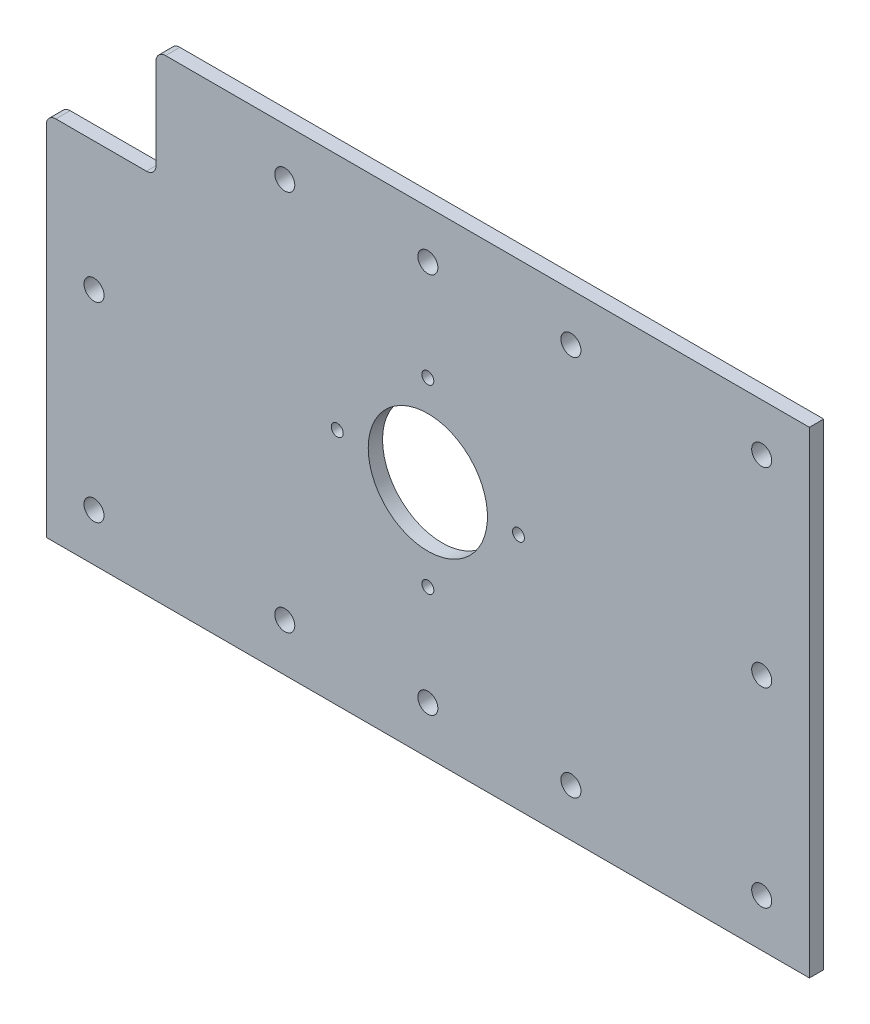
from build123d import *

# Parameters (mm, degrees)
SKETCH_1_W               = 160
SKETCH_1_H               = 100
EXTRUDE_1_DEPTH          = 3
SKETCH_2_R               = 2.1
CUT_EXTRUDE_1_DEPTH      = 95.387499172
CUT_EXTRUDE_2_DEPTH      = 95.387499172
CUT_EXTRUDE_2_DEPTH_BACK = 95.387499172
SKETCH_3_R               = 1.25
CUT_EXTRUDE_3_DEPTH      = 95.387499172
CUT_EXTRUDE_3_DEPTH_BACK = 95.387499172
SKETCH_4_R               = 12.5
CUT_EXTRUDE_4_DEPTH      = 95.387499172
CUT_EXTRUDE_4_DEPTH_BACK = 95.387499172
SKETCH_5_W               = 23
SKETCH_5_H               = 23
FILLET_1_R               = 2


with BuildPart() as part:
    # 草图1 → 凸台-拉伸1 (new body)
    with BuildSketch(Plane.XY):
        Rectangle(SKETCH_1_W, SKETCH_1_H)
    extrude(amount=EXTRUDE_1_DEPTH)

    # 草图2 → 切除-拉伸1 (cut, through all)
    with BuildSketch(Plane.XY.offset(3)):
        with Locations((-70, 40)):
            Circle(SKETCH_2_R)
        with Locations((-30, 40)):
            Circle(SKETCH_2_R)
        with Locations((0, 40)):
            Circle(SKETCH_2_R)
        with Locations((30, 40)):
            Circle(SKETCH_2_R)
        with Locations((70, 40)):
            Circle(SKETCH_2_R)
        with Locations((-70, 0)):
            Circle(SKETCH_2_R)
        with Locations((-70, -40)):
            Circle(SKETCH_2_R)
        with Locations((-70, -80)):
            Circle(SKETCH_2_R)
        with Locations((-70, -120)):
            Circle(SKETCH_2_R)
        with Locations((-70, -160)):
            Circle(SKETCH_2_R)
        with Locations((-70, -200)):
            Circle(SKETCH_2_R)
        with Locations((-70, -240)):
            Circle(SKETCH_2_R)
        with Locations((-70, -280)):
            Circle(SKETCH_2_R)
        with Locations((70, -280)):
            Circle(SKETCH_2_R)
        with Locations((70, -240)):
            Circle(SKETCH_2_R)
        with Locations((70, -200)):
            Circle(SKETCH_2_R)
        with Locations((70, -160)):
            Circle(SKETCH_2_R)
        with Locations((70, -120)):
            Circle(SKETCH_2_R)
        with Locations((70, -80)):
            Circle(SKETCH_2_R)
        with Locations(Location((70, -40, 0), (0, 0, 180))):
            Circle(SKETCH_2_R)
        with Locations(Location((70, 0, 0), (0, 0, 180))):
            Circle(SKETCH_2_R)
        with Locations(Location((30, -40, 0), (0, 0, 180))):
            Circle(SKETCH_2_R)
        with Locations(Location((0, -40, 0), (0, 0, 180))):
            Circle(SKETCH_2_R)
        with Locations(Location((-30, -40, 0), (0, 0, 180))):
            Circle(SKETCH_2_R)
    extrude(amount=-CUT_EXTRUDE_1_DEPTH, mode=Mode.SUBTRACT)

    # 草图3 → 切除-拉伸2 (cut, two sides: drawn at the far end of the back side and taken through both)
    with BuildSketch(Plane(origin=(0, 0, 0), x_dir=(-1, 0, 0), z_dir=(0, 0, -1)).offset(-CUT_EXTRUDE_2_DEPTH_BACK)):
        with Locations((19, 0)):
            Circle(SKETCH_3_R)
        with Locations((0, -19)):
            Circle(SKETCH_3_R)
        with Locations((-19, 0)):
            Circle(SKETCH_3_R)
        with Locations((0, 19)):
            Circle(SKETCH_3_R)
    extrude(amount=CUT_EXTRUDE_2_DEPTH + CUT_EXTRUDE_2_DEPTH_BACK, mode=Mode.SUBTRACT)

    # 草图4 → 切除-拉伸3 (cut, two sides: drawn at the far end of the back side and taken through both)
    with BuildSketch(Plane(origin=(0, 0, 0), x_dir=(-1, 0, 0), z_dir=(0, 0, -1)).offset(-CUT_EXTRUDE_3_DEPTH_BACK)):
        Circle(SKETCH_4_R)
    extrude(amount=CUT_EXTRUDE_3_DEPTH + CUT_EXTRUDE_3_DEPTH_BACK, mode=Mode.SUBTRACT)

    # 草图5 → 切除-拉伸4 (cut, two sides: drawn at the far end of the back side and taken through both)
    with BuildSketch(Plane.XY.offset(3).offset(-CUT_EXTRUDE_4_DEPTH_BACK)):
        with Locations((-68.5, 38.5)):
            Rectangle(SKETCH_5_W, SKETCH_5_H)
    extrude(amount=CUT_EXTRUDE_4_DEPTH + CUT_EXTRUDE_4_DEPTH_BACK, mode=Mode.SUBTRACT)

    # 圆角1
    fillet_1_edges = [part.edges().sort_by_distance(p)[0] for p in [
        (-80, 27, 1.5),
        (-57, 50, 1.5),
        (-57, 27, 1.5),
    ]]
    fillet(fillet_1_edges, radius=FILLET_1_R)


solid = part.part
